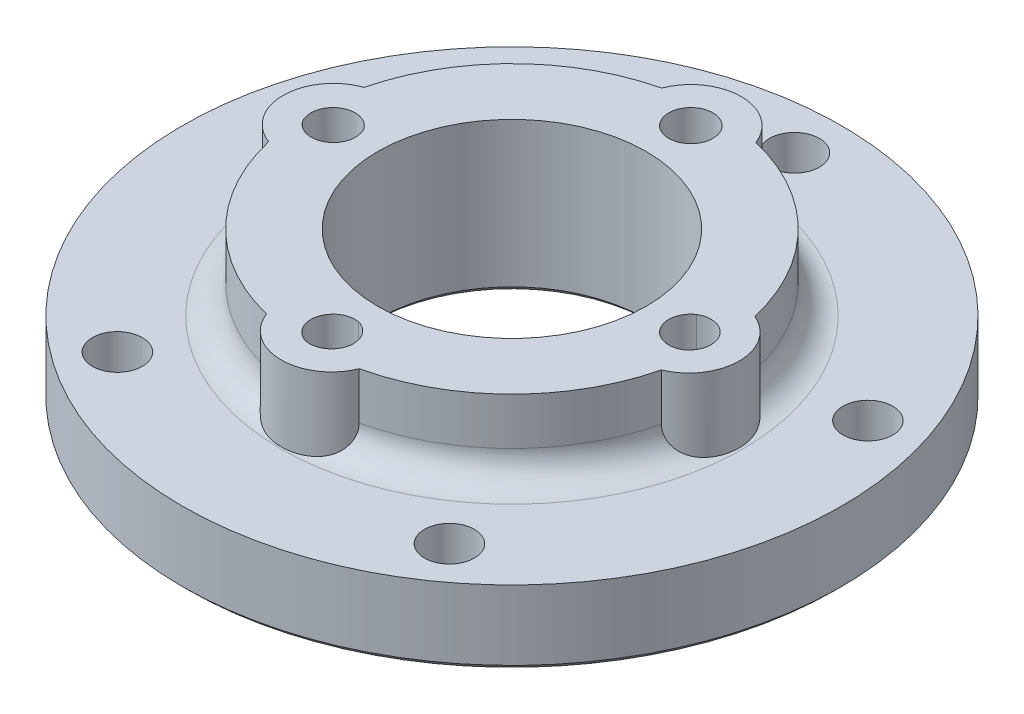
from build123d import *

# Parameters (mm, degrees)
SKETCH2_R           = 35
SKETCH2_R_2         = 21
SKETCH2_R_3         = 2.65
BOSS_EXTRUDE6_DEPTH = 8
SKETCH3_R           = 21.5
SKETCH3_R_2         = 14.25
BOSS_EXTRUDE7_DEPTH = 16
FILLET1_R           = 3
SKETCH4_R           = 2.35
CUT_EXTRUDE1_DEPTH  = 15
BOSS_EXTRUDE9_REACH = 54.019
SKETCH7_R           = 2.35
CHAMFER1_SIZE       = 0.6


with BuildPart() as part:
    # Sketch2 → Boss-Extrude6 (new body)
    with BuildSketch(Plane(origin=(0, 0, 0), x_dir=(1, 0, 0), z_dir=(0, 1, 0))):
        with Locations(Location((0, 0, 0), (0, 0, 270))):
            Circle(SKETCH2_R)
        with Locations(Location((0, 0, 0), (0, 0, 270))):
            Circle(SKETCH2_R_2, mode=Mode.SUBTRACT)
        with Locations(Location((0, 30, 0), (0, 0, 270))):
            Circle(SKETCH2_R_3, mode=Mode.SUBTRACT)
        with Locations(Location((28.531695489, 9.270509831, 0), (0, 0, 270))):
            Circle(SKETCH2_R_3, mode=Mode.SUBTRACT)
        with Locations(Location((17.633557569, -24.270509831, 0), (0, 0, 270))):
            Circle(SKETCH2_R_3, mode=Mode.SUBTRACT)
        with Locations(Location((-17.633557569, -24.270509831, 0), (0, 0, 270))):
            Circle(SKETCH2_R_3, mode=Mode.SUBTRACT)
        with Locations(Location((-28.531695489, 9.270509831, 0), (0, 0, 270))):
            Circle(SKETCH2_R_3, mode=Mode.SUBTRACT)
    extrude(amount=BOSS_EXTRUDE6_DEPTH)

    # Sketch3 → Boss-Extrude7 (add)
    with BuildSketch(Plane(origin=(0, 0, 0), x_dir=(1, 0, 0), z_dir=(0, 1, 0))):
        with Locations(Location((0, 0, 0), (0, 0, 270))):
            Circle(SKETCH3_R)
        with Locations(Location((0, 0, 0), (0, 0, 270))):
            Circle(SKETCH3_R_2, mode=Mode.SUBTRACT)
    extrude(amount=BOSS_EXTRUDE7_DEPTH)

    # Fillet1
    fillet1_edges = [part.edges().sort_by_distance(p)[0] for p in [
        (0, 8, -21.5),
    ]]
    fillet(fillet1_edges, radius=FILLET1_R)

    # Sketch4 → Cut-Extrude1 (cut)
    with BuildSketch(Plane(origin=(0, 16, 0), x_dir=(1, 0, 0), z_dir=(0, 1, 0))):
        with Locations(Location((0, 19, 0), (0, 0, 270))):
            Circle(SKETCH4_R)
        with Locations(Location((19, 0, 0), (0, 0, 270))):
            Circle(SKETCH4_R)
        with Locations(Location((0, -19, 0), (0, 0, 270))):
            Circle(SKETCH4_R)
        with Locations(Location((-19, 0, 0), (0, 0, 270))):
            Circle(SKETCH4_R)
    extrude(amount=-CUT_EXTRUDE1_DEPTH, mode=Mode.SUBTRACT)

    # Boss-Extrude9: up to this face of the body (flat: up to its plane)
    boss_extrude9_end = Plane(part.part.faces().sort_by_distance((0, 8, -25.489949494))[0])
    # Sketch7 → Boss-Extrude9 (add, up to the picked face)
    with BuildSketch(Plane(origin=(0, 16, 0), x_dir=(1, 0, 0), z_dir=(0, 1, 0)), mode=Mode.PRIVATE) as boss_extrude9_sk1:
        with BuildLine():
            Line((-4.477866444, 16.072336749), (4.398028303, 15.953715863))
            ThreePointArc((4.398028303, 15.953715863), (0.071493082, 24.349522291), (-4.477866444, 16.072336749))
        make_face()
        with Locations(Location((0, 19, 0), (0, 0, 270))):
            Circle(SKETCH7_R, mode=Mode.SUBTRACT)
    boss_extrude9_tool1 = split(extrude(boss_extrude9_sk1.sketch, amount=-BOSS_EXTRUDE9_REACH, mode=Mode.PRIVATE), bisect_by=boss_extrude9_end, keep=Keep.BOTH, mode=Mode.PRIVATE)
    # Sketch7 → Boss-Extrude9 (add, up to the picked face)
    with BuildSketch(Plane(origin=(0, 16, 0), x_dir=(1, 0, 0), z_dir=(0, 1, 0)), mode=Mode.PRIVATE) as boss_extrude9_sk2:
        with BuildLine():
            Line((15.946789092, 4.395782427), (15.828168206, -4.48011232))
            ThreePointArc((15.828168206, -4.48011232), (24.223974633, -0.153577099), (15.946789092, 4.395782427))
        make_face()
        with Locations((18.874452343, -0.082084016)):
            Circle(SKETCH7_R, mode=Mode.SUBTRACT)
    boss_extrude9_tool2 = split(extrude(boss_extrude9_sk2.sketch, amount=-BOSS_EXTRUDE9_REACH, mode=Mode.PRIVATE), bisect_by=boss_extrude9_end, keep=Keep.BOTH, mode=Mode.PRIVATE)
    # Sketch7 → Boss-Extrude9 (add, up to the picked face)
    with BuildSketch(Plane(origin=(0, 16, 0), x_dir=(1, 0, 0), z_dir=(0, 1, 0)), mode=Mode.PRIVATE) as boss_extrude9_sk3:
        with BuildLine():
            Line((4.27023477, -16.028873108), (-4.605659977, -15.910252222))
            ThreePointArc((-4.605659977, -15.910252222), (-0.279124756, -24.30605865), (4.27023477, -16.028873108))
        make_face()
        with Locations((-0.207631674, -18.956536359)):
            Circle(SKETCH7_R, mode=Mode.SUBTRACT)
    boss_extrude9_tool3 = split(extrude(boss_extrude9_sk3.sketch, amount=-BOSS_EXTRUDE9_REACH, mode=Mode.PRIVATE), bisect_by=boss_extrude9_end, keep=Keep.BOTH, mode=Mode.PRIVATE)
    # Sketch7 → Boss-Extrude9 (add, up to the picked face)
    with BuildSketch(Plane(origin=(0, 16, 0), x_dir=(1, 0, 0), z_dir=(0, 1, 0)), mode=Mode.PRIVATE) as boss_extrude9_sk4:
        with BuildLine():
            Line((-16.154420765, -4.352318786), (-16.035799879, 4.523575961))
            ThreePointArc((-16.035799879, 4.523575961), (-24.431606307, 0.19704074), (-16.154420765, -4.352318786))
        make_face()
        with Locations((-19.082084016, 0.125547657)):
            Circle(SKETCH7_R, mode=Mode.SUBTRACT)
    boss_extrude9_tool4 = split(extrude(boss_extrude9_sk4.sketch, amount=-BOSS_EXTRUDE9_REACH, mode=Mode.PRIVATE), bisect_by=boss_extrude9_end, keep=Keep.BOTH, mode=Mode.PRIVATE)
    add(boss_extrude9_tool1.solids().sort_by(Axis((0.069676, 16, -24.213524), (0, -1, 0)))[0])
    add(boss_extrude9_tool2.solids().sort_by(Axis((16.023477, 16, 0.043982), (0, -1, 0)))[0])
    add(boss_extrude9_tool3.solids().sort_by(Axis((-0.277307, 16, 24.170061), (0, -1, 0)))[0])
    add(boss_extrude9_tool4.solids().sort_by(Axis((-16.231108, 16, -0.087446), (0, -1, 0)))[0])

    # Chamfer1
    chamfer1_edges = [part.edges().sort_by_distance(p)[0] for p in [
        (28.531695489, 0, -11.920509831),
        (17.633557569, 0, 21.620509831),
        (0, 0, -35),
        (-17.633557569, 0, 21.620509831),
        (-28.531695489, 0, -11.920509831),
        (0, 0, -14.25),
        (0, 0, -32.65),
    ]]
    chamfer(chamfer1_edges, length=CHAMFER1_SIZE)


solid = part.part
